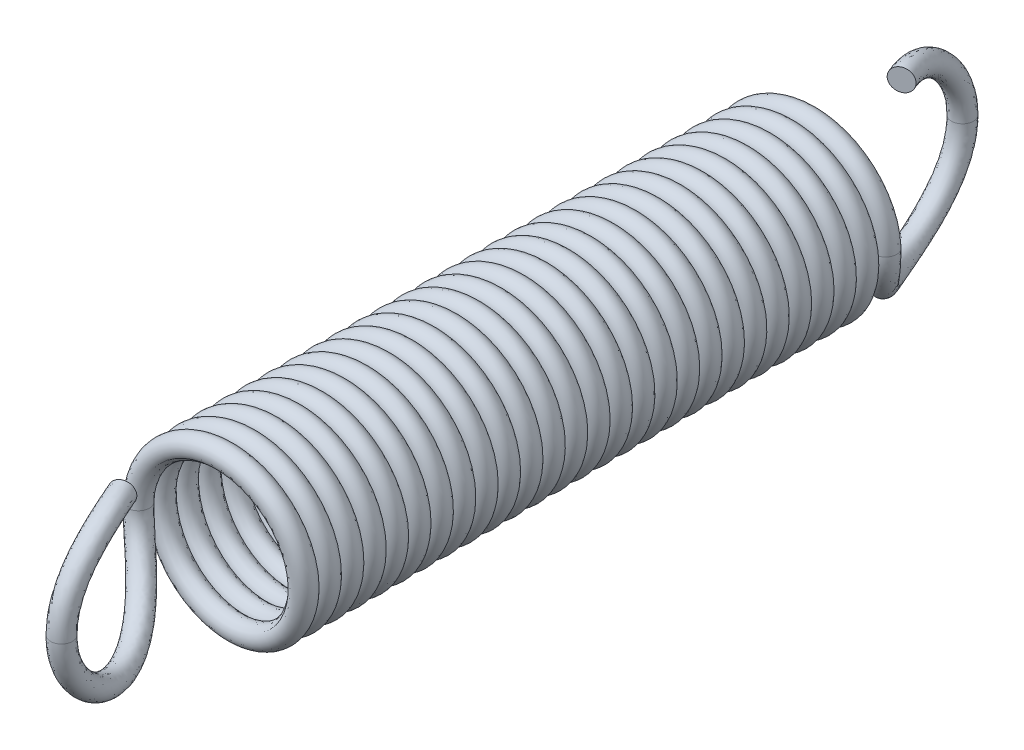
from build123d import *

# Parameters (mm, degrees)
SPRING_BODY_SWEEP_PITCH      = 0.254716981
SPRING_BODY_SWEEP_HEIGHT     = 6.75
SPRING_BODY_SWEEP_RADIUS     = 0.875
SKETCH4_R                    = 0.125
SKETCH7_R                    = 0.125
SPRING_HOOK_CIRPATTERN_COUNT = 2


with BuildPart() as part:
    # Spring Body Sweep: sweep along a helix
    with BuildLine() as spring_body_sweep_path:
        Helix(SPRING_BODY_SWEEP_PITCH, SPRING_BODY_SWEEP_HEIGHT, SPRING_BODY_SWEEP_RADIUS, center=(0, 0, 3.375), direction=(0, 0, -1))
    # Sketch4 → Spring Body Sweep (sweep)
    with BuildSketch(Plane(origin=(0, 0, 0), x_dir=(1, 0, 0), z_dir=(0, 1, 0))):
        with Locations((-0.875, -3.375)):
            Circle(SKETCH4_R)
    sweep(path=spring_body_sweep_path.line, is_frenet=True)

    # Spring Hook Sweep: sweep along a curve in space
    with BuildLine() as spring_hook_sweep_path:
        add(Edge.make_bspline(
            [(-0.875, 0, 3.375), (-0.875, -0.070805975, 3.375), (-0.862772235, -0.142566876, 3.384040512), (-0.842100093, -0.208340317, 3.400165127), (-0.820557529, -0.276883219, 3.416968685), (-0.789876947, -0.341111034, 3.441587995), (-0.755484161, -0.399202723, 3.471371599), (-0.691914208, -0.506576575, 3.526422166), (-0.614231495, -0.597488391, 3.600772251), (-0.538489819, -0.670379258, 3.687668558), (-0.473635721, -0.732792341, 3.762073852), (-0.408100299, -0.783489199, 3.847782126), (-0.347866985, -0.818774481, 3.941400989), (-0.295778719, -0.849288312, 4.022360244), (-0.246637686, -0.868715767, 4.110907526), (-0.204094971, -0.873702254, 4.202362075), (-0.164487122, -0.878344741, 4.287507509), (-0.129822191, -0.870384084, 4.377019733), (-0.102206748, -0.848386766, 4.464160909), (-0.074442255, -0.82627072, 4.55177242), (-0.053132475, -0.789252645, 4.639124616), (-0.03819732, -0.739328766, 4.717993564), (-0.022853018, -0.68803723, 4.799023113), (-0.013677324, -0.621685863, 4.873326217), (-0.008369672, -0.545899403, 4.933826617), (-0.003024208, -0.469573047, 4.994758015), (-0.001280094, -0.381538157, 5.043485997), (-0.000552998, -0.289228023, 5.075816051), (0.000173971, -0.196934016, 5.108140457), (0, -0.097793556, 5.125), (0, 0, 5.125)],
            knots=[0, 0, 0, 0, 0.072250684, 0.072250684, 0.072250684, 0.147152191, 0.147152191, 0.147152191, 0.286817237, 0.286817237, 0.286817237, 0.40587105, 0.40587105, 0.40587105, 0.508738877, 0.508738877, 0.508738877, 0.604571757, 0.604571757, 0.604571757, 0.701066437, 0.701066437, 0.701066437, 0.800274482, 0.800274482, 0.800274482, 0.900154018, 0.900154018, 0.900154018, 1, 1, 1, 1], degree=3))
        add(Edge.make_bspline(
            [(0, 0, 5.125), (0, 0.080420096, 5.125), (8.109e-05, 0.16159397, 5.113701146), (-0.000252879, 0.238956439, 5.091739164), (-0.000647463, 0.330359888, 5.06579117), (-0.00165566, 0.418633896, 5.024199006), (-0.005477287, 0.496787429, 4.970296641), (-0.009246865, 0.57387655, 4.917128399), (-0.015983134, 0.643131563, 4.850538761), (-0.027974516, 0.699038488, 4.776279576), (-0.040455327, 0.757227258, 4.698989497), (-0.059164802, 0.802513443, 4.61118401), (-0.084830813, 0.831738865, 4.521726811), (-0.110441497, 0.860901288, 4.432462449), (-0.143688356, 0.875, 4.339210781), (-0.182623133, 0.875, 4.25)],
            knots=[0, 0, 0, 0, 0.172663438, 0.172663438, 0.172663438, 0.377470029, 0.377470029, 0.377470029, 0.579502238, 0.579502238, 0.579502238, 0.790104202, 0.790104202, 0.790104202, 1, 1, 1, 1], degree=3))
    # Sketch7 → Spring Hook Sweep (sweep)
    with BuildSketch(Plane.XZ):
        with Locations((-0.875, 3.375)):
            Circle(SKETCH7_R)
    spring_hook_sweep = sweep(path=spring_hook_sweep_path.line)

    # Spring Hook CirPattern: Spring Hook Sweep ×2 about axis
    spring_hook_cirpattern_axis = Axis((0, 2.540341184, 0), (0, -1, 0))
    for i in range(1, SPRING_HOOK_CIRPATTERN_COUNT):
        add(spring_hook_sweep.rotate(spring_hook_cirpattern_axis, i * 360 / SPRING_HOOK_CIRPATTERN_COUNT))


solid = part.part
